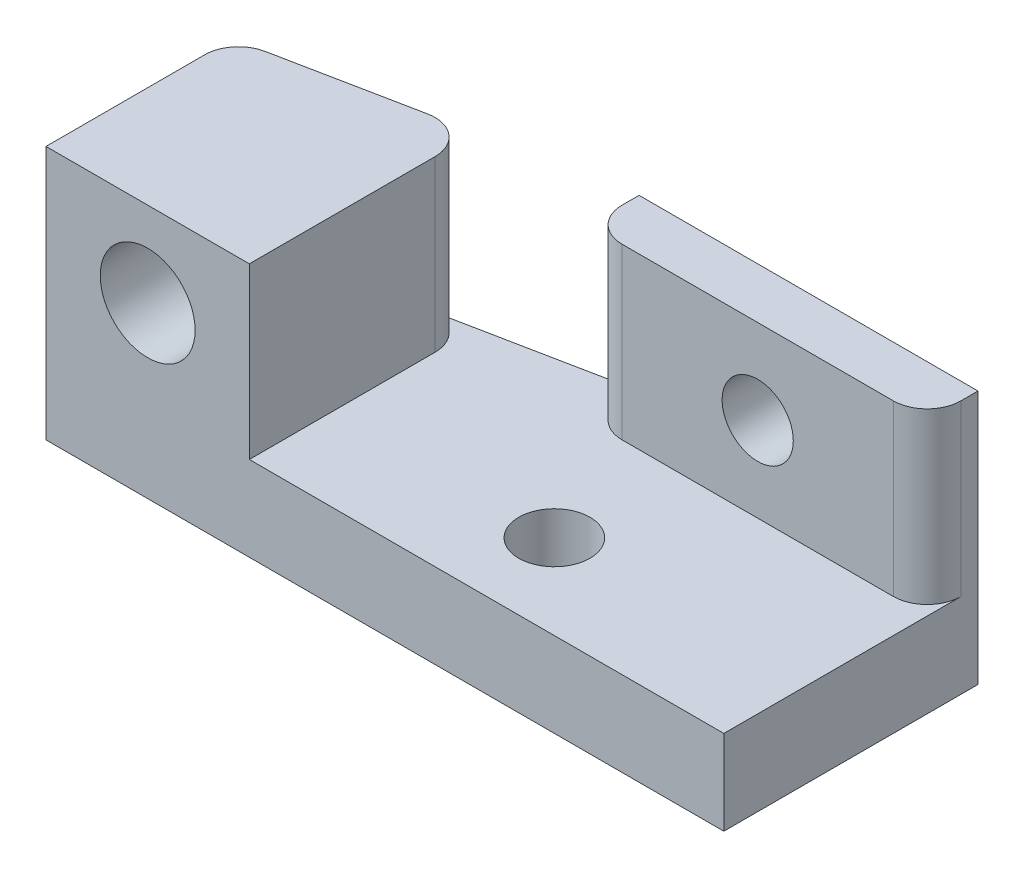
from build123d import *

# Parameters (mm, degrees)
ESQUISSE1_R             = 2.1
BOSS_EXTRU_1_DEPTH      = 5
ESQUISSE2_W             = 20
ESQUISSE2_H             = 3
BOSS_EXTRU_2_DEPTH      = 10
ESQUISSE3_R             = 2.8
ENL_V_MAT_EXTRU_1_DEPTH = 9.1
ESQUISSE4_R             = 2.1
ENL_V_MAT_EXTRU_2_DEPTH = 9.1
CONG_2_R                = 2


with BuildPart() as part:
    # Esquisse1 → Boss.-Extru.1 (new body)
    with BuildSketch(Plane(origin=(0, 0, 0), x_dir=(1, 0, 0), z_dir=(0, 1, 0))):
        Polygon((20, 0), (20, -15), (-20, -15), (-20, -4), (0, 0), align=None)
        with Locations((5, -10)):
            Circle(ESQUISSE1_R, mode=Mode.SUBTRACT)
    extrude(amount=BOSS_EXTRU_1_DEPTH)

    # Esquisse2 → Boss.-Extru.2 (add)
    with BuildSketch(Plane(origin=(0, 5, 0), x_dir=(1, 0, 0), z_dir=(0, 1, 0))):
        with Locations((10, -1.5)):
            Rectangle(ESQUISSE2_W, ESQUISSE2_H)
        Polygon((-8, -1.6), (-20, -4), (-20, -15), (-8, -15), align=None)
    extrude(amount=BOSS_EXTRU_2_DEPTH)

    # Esquisse3 → Enlèv. mat.-Extru.1 (cut)
    with BuildSketch(Plane.XY.offset(15)):
        with Locations((-14, 10)):
            Circle(ESQUISSE3_R)
    extrude(amount=-ENL_V_MAT_EXTRU_1_DEPTH, mode=Mode.SUBTRACT)

    # Esquisse4 → Enlèv. mat.-Extru.2 (cut)
    with BuildSketch(Plane.XY.offset(3)):
        with Locations((10, 10)):
            Circle(ESQUISSE4_R)
    extrude(amount=-ENL_V_MAT_EXTRU_2_DEPTH, mode=Mode.SUBTRACT)

    # Congé2
    cong_2_edges = [part.edges().sort_by_distance(p)[0] for p in [
        (20, 10, 3),
        (0, 10, 3),
        (-20, 7.5, 4),
        (-8, 10, 1.6),
    ]]
    fillet(cong_2_edges, radius=CONG_2_R)


solid = part.part
